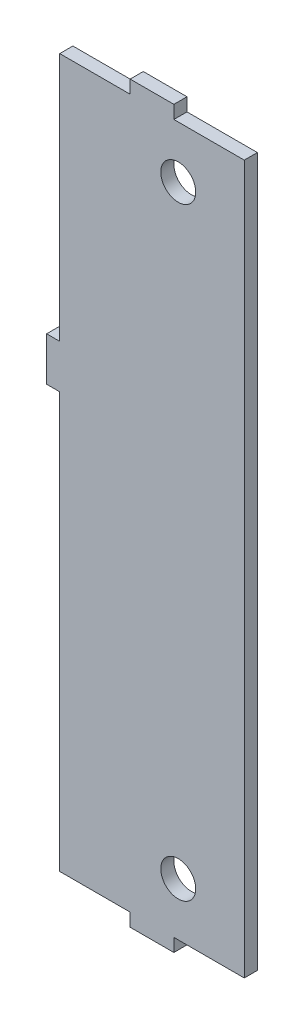
from build123d import *

# Parameters (mm, degrees)
BOSS_EXTRUDE1_DEPTH      = 1.5
F_8_0_8_DIAMETER_HOLE1_D = 8


with BuildPart() as part:
    # Sketch1 → Boss-Extrude1 (new, symmetric)
    with BuildSketch(Plane.XY):
        Polygon((-5, 0), (5, 0), (5, -3), (21.1, -3), (21.1, -165), (5, -165), (5, -168), (-5, -168), (-5, -165), (-21.1, -165), (-21.1, -70), (-24.1, -70), (-24.1, -60), (-21.1, -60), (-21.1, -3), (-5, -3), align=None)
    extrude(amount=BOSS_EXTRUDE1_DEPTH, both=True)

    # Ø8.0 (8) Diameter Hole1 (through all)
    with Locations(Plane.XY.offset(1.5)):
        with Locations((6, -14.9), (6, -152.9)):
            Hole(F_8_0_8_DIAMETER_HOLE1_D / 2)


solid = part.part
